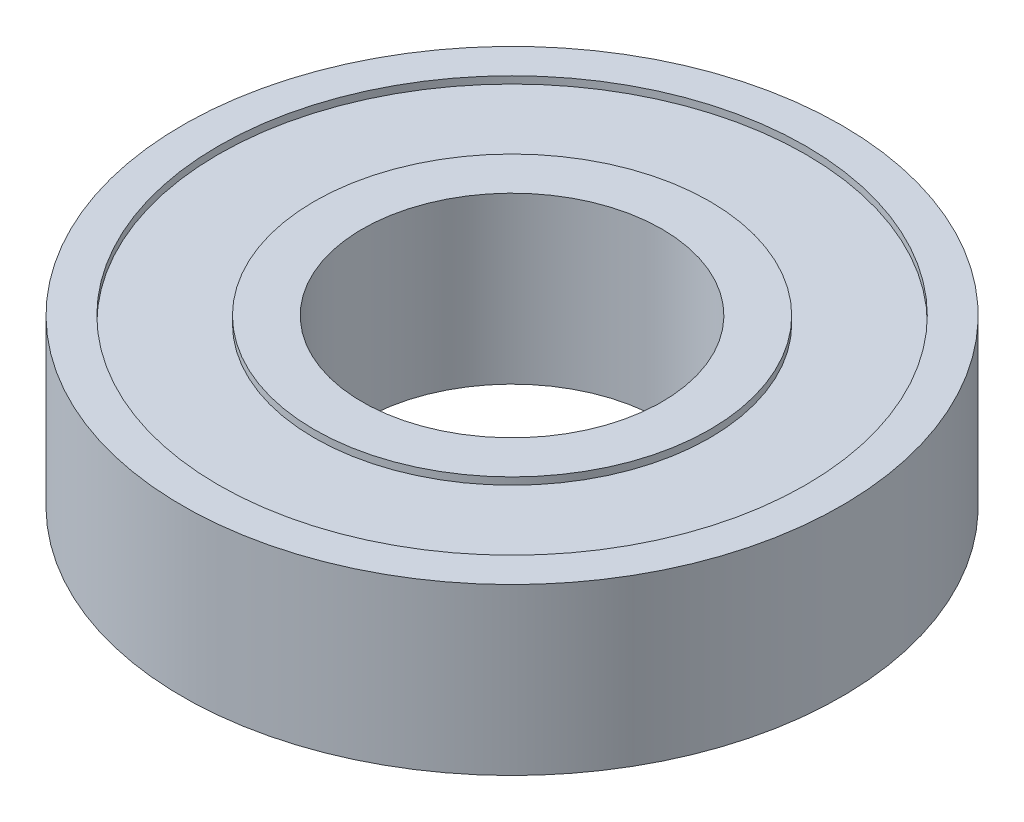
from build123d import *


with BuildPart() as part:
    # Sketch1 → Revolve1 (revolve)
    with BuildSketch(Plane.XY, mode=Mode.PRIVATE) as revolve1_sk:
        Polygon((7.9375, 8.382), (7.9375, -0.381), (10.4775, -0.381), (10.4775, 0), (15.5575, 0), (15.5575, -0.381), (17.4625, -0.381), (17.4625, 8.382), (15.5575, 8.382), (15.5575, 8.001), (10.4775, 8.001), (10.4775, 8.382), align=None)
    revolve(revolve1_sk.sketch.rotate(Axis((0, 0, 0), (0, 1, 0)), 90), axis=Axis((0, 0, 0), (0, 1, 0)))


solid = part.part
